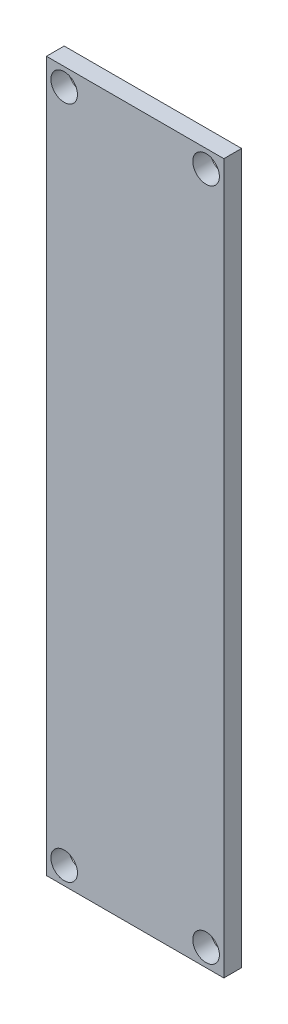
from build123d import *

# Parameters (mm, degrees)
SKETCH1_W           = 20
SKETCH1_H           = 80
BOSS_EXTRUDE1_DEPTH = 2
SKETCH2_R           = 1.5
CUT_EXTRUDE1_DEPTH  = 2


with BuildPart() as part:
    # Sketch1 → Boss-Extrude1 (new body)
    with BuildSketch(Plane.XY):
        with Locations((41.807469586, -63.062820491)):
            Rectangle(SKETCH1_W, SKETCH1_H)
    extrude(amount=BOSS_EXTRUDE1_DEPTH)

    # Sketch2 → Cut-Extrude1 (cut)
    with BuildSketch(Plane.XY.offset(2)):
        with Locations((33.807469586, -25.062820491)):
            Circle(SKETCH2_R)
        with Locations(Location((49.807469586, -25.062820491, 0), (0, 0, 180))):
            Circle(SKETCH2_R)
        with Locations(Location((33.807469586, -101.062820491, 0), (0, 0, 180))):
            Circle(SKETCH2_R)
        with Locations((49.807469586, -101.062820491)):
            Circle(SKETCH2_R)
    extrude(amount=-CUT_EXTRUDE1_DEPTH, mode=Mode.SUBTRACT)


solid = part.part
